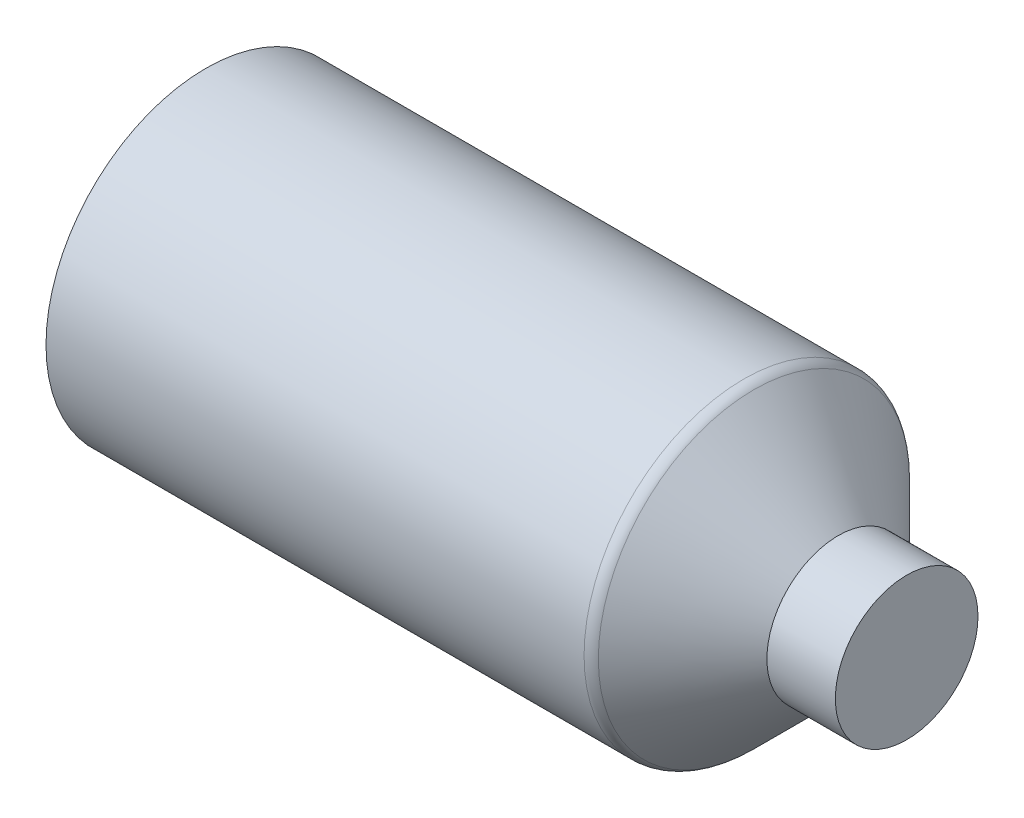
from build123d import *


with BuildPart() as part:
    # Sketch3 → Revolve1 (revolve)
    with BuildSketch(Plane.XY, mode=Mode.PRIVATE) as revolve1_sk:
        with BuildLine():
            Line((-76.2, 17.78), (-76.2, 11.43))
            Line((-76.2, 11.43), (-15.663873033, 11.43))
            Line((-15.663873033, 11.43), (-15.663873033, 0))
            Line((-15.663873033, 0), (-5.821373033, 0))
            Line((-5.821373033, 0), (1.798626967, 0))
            Line((1.798626967, 0), (1.798626967, 7.9375))
            Line((1.798626967, 7.9375), (-5.821373033, 7.9375))
            Line((-5.821373033, 7.9375), (-15.198905048, 17.315032015))
            ThreePointArc((-15.198905048, 17.315032015), (-15.713927115, 17.659158758), (-16.321437064, 17.78))
            Line((-16.321437064, 17.78), (-76.2, 17.78))
        make_face()
    revolve(revolve1_sk.sketch.rotate(Axis((24.172114646, 0, 0), (-1, 0, 0)), 90), axis=Axis((24.172114646, 0, 0), (-1, 0, 0)))


solid = part.part
